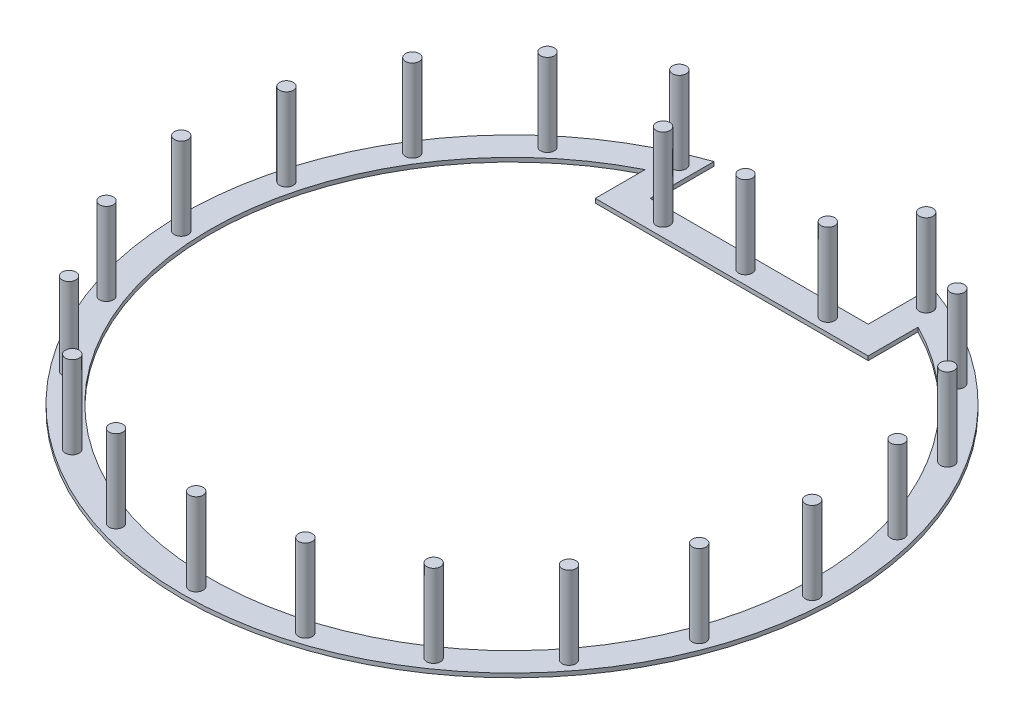
from build123d import *

# Parameters (mm, degrees)
BOSS_EXTRUDE1_DEPTH             = 150
BOSS_EXTRUDE2_START             = -150
BOSS_EXTRUDE2_DEPTH             = 150
CUT_EXTRUDE1_DEPTH              = 2000
SKETCH5_R                       = 250
BOSS_EXTRUDE4_DEPTH             = 3000
CIRPATTERN3_COUNT               = 10
CIRPATTERN3_ANGLE               = 157
CIRPATTERN3_THE_OTHER_WAY_COUNT = 10
CIRPATTERN3_THE_OTHER_WAY_ANGLE = 157
SKETCH6_R                       = 250
BOSS_EXTRUDE5_DEPTH             = 3000
LPATTERN1_COUNT                 = 2
LPATTERN1_PITCH                 = 3000
LPATTERN1_COL_COUNT             = 2
LPATTERN1_COL_PITCH             = 3000


with BuildPart() as part:
    # Sketch2 → Boss-Extrude1 (new body)
    with BuildSketch(Plane(origin=(0, 0, 0), x_dir=(1, 0, 0), z_dir=(0, 1, 0))):
        with BuildLine():
            Line((7937.253933194, 9000), (-7937.253933194, 9000))
            ThreePointArc((-7937.253933194, 9000), (-4937.253933194, -10937.253933194), (12000, 0))
            ThreePointArc((12000, 0), (10937.253933194, 4937.253933194), (7937.253933194, 9000))
        make_face()
    extrude(amount=BOSS_EXTRUDE1_DEPTH)

    # Sketch3 → Boss-Extrude2 (add)
    with BuildSketch(Plane(origin=(0, 150, 0), x_dir=(1, 0, 0), z_dir=(0, 1, 0)).offset(BOSS_EXTRUDE2_START)):
        with BuildLine():
            Line((-3968.626966597, 9000), (-7937.253933194, 9000))
            ThreePointArc((-7937.253933194, 9000), (-6065.362113009, 10354.292947279), (-3968.626966597, 11324.751652906))
            Line((-3968.626966597, 11324.751652906), (-3968.626966597, 9000))
        make_face()
        with BuildLine():
            Line((3968.626966597, 9000), (7937.253933194, 9000))
            ThreePointArc((7937.253933194, 9000), (6065.362113009, 10354.292947279), (3968.626966597, 11324.751652906))
            Line((3968.626966597, 11324.751652906), (3968.626966597, 9000))
        make_face()
    extrude(amount=BOSS_EXTRUDE2_DEPTH)

    # Sketch4 → Cut-Extrude1 (cut)
    with BuildSketch(Plane(origin=(0, 150, 0), x_dir=(1, 0, 0), z_dir=(0, 1, 0))):
        with BuildLine():
            Line((4968.626966597, 8000), (-4968.626966597, 8000))
            Line((-4968.626966597, 8000), (-4968.626966597, 9813.905749843))
            ThreePointArc((-4968.626966597, 9813.905749843), (0, -11000), (4968.626966597, 9813.905749843))
            Line((4968.626966597, 9813.905749843), (4968.626966597, 8000))
        make_face()
    extrude(amount=-CUT_EXTRUDE1_DEPTH, mode=Mode.SUBTRACT)

    # Sketch5 → Boss-Extrude4 (add)
    with BuildSketch(Plane(origin=(0, 150, 0), x_dir=(1, 0, 0), z_dir=(0, 1, 0))):
        with Locations(Location((0, -11500, 0), (0, 0, 270))):
            Circle(SKETCH5_R)
    boss_extrude4 = extrude(amount=BOSS_EXTRUDE4_DEPTH)

    # CirPattern3: Boss-Extrude4 ×10 about axis
    cirpattern3_axis = Axis((0, 0, 0), (0, -1, 0))
    for i in range(1, CIRPATTERN3_COUNT):
        add(boss_extrude4.rotate(cirpattern3_axis, i * CIRPATTERN3_ANGLE / (CIRPATTERN3_COUNT - 1)))

    # CirPattern3 the other way: Boss-Extrude4 ×10 about axis
    cirpattern3_the_other_way_axis = Axis((0, 0, 0), (0, 1, 0))
    for i in range(1, CIRPATTERN3_THE_OTHER_WAY_COUNT):
        add(boss_extrude4.rotate(cirpattern3_the_other_way_axis, i * CIRPATTERN3_THE_OTHER_WAY_ANGLE / (CIRPATTERN3_THE_OTHER_WAY_COUNT - 1)))

    # Sketch6 → Boss-Extrude5 (add)
    with BuildSketch(Plane(origin=(0, 150, 0), x_dir=(1, 0, 0), z_dir=(0, 1, 0))):
        with Locations(Location((0, 8500, 0), (0, 0, 270))):
            Circle(SKETCH6_R)
    boss_extrude5 = extrude(amount=BOSS_EXTRUDE5_DEPTH)

    # LPattern1: Boss-Extrude5 ×2
    with Locations(*[(i * LPATTERN1_PITCH, 0, 0) for i in range(1, LPATTERN1_COUNT)]):
        add(boss_extrude5)

    # LPattern1 col: Boss-Extrude5 ×2
    with Locations(*[(-i * LPATTERN1_COL_PITCH, 0, 0) for i in range(1, LPATTERN1_COL_COUNT)]):
        add(boss_extrude5)


solid = part.part
